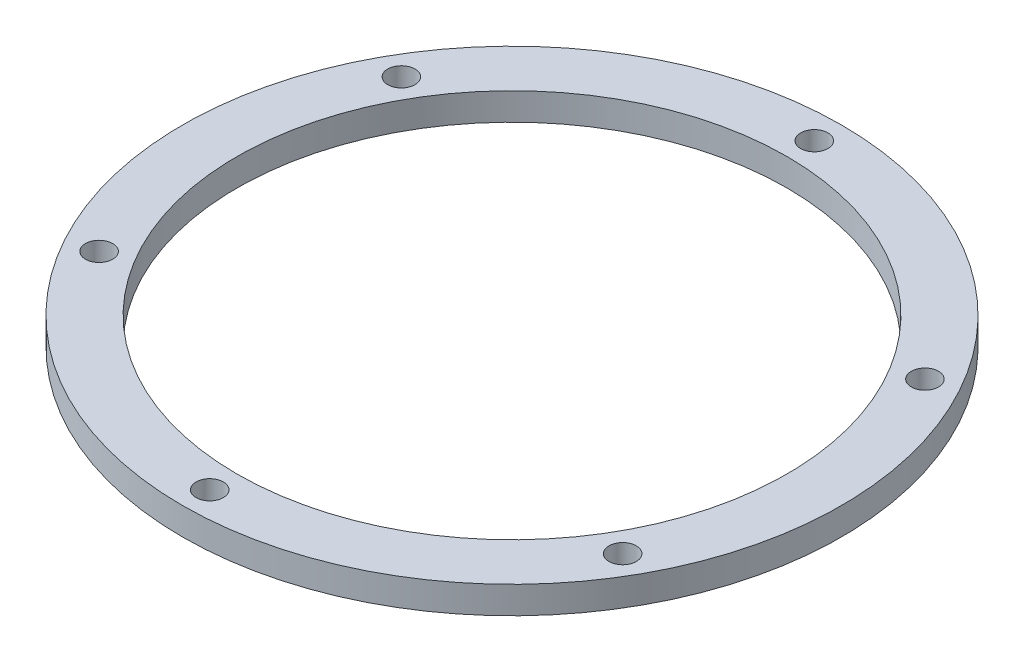
from build123d import *

# Parameters (mm, degrees)
SKETCH1_R           = 36.25
SKETCH1_R_2         = 30.25
BOSS_EXTRUDE1_DEPTH = 3
SKETCH2_R           = 1.5
CUT_EXTRUDE1_DEPTH  = 52.352945388
CIRPATTERN1_COUNT   = 6


with BuildPart() as part:
    # Sketch1 → Boss-Extrude1 (new body)
    with BuildSketch(Plane(origin=(0, 0, 0), x_dir=(1, 0, 0), z_dir=(0, 1, 0))):
        with Locations(Location((0, 0, 0), (0, 0, 270))):
            Circle(SKETCH1_R)
        with Locations(Location((0, 0, 0), (0, 0, 270))):
            Circle(SKETCH1_R_2, mode=Mode.SUBTRACT)
    extrude(amount=BOSS_EXTRUDE1_DEPTH)

    # Sketch2 → Cut-Extrude1 (cut, symmetric)
    with BuildSketch(Plane(origin=(0, 3, 0), x_dir=(1, 0, 0), z_dir=(0, 1, 0))):
        with Locations(Location((0, 33.25, 0), (0, 0, 270))):
            Circle(SKETCH2_R)
    cut_extrude1 = extrude(amount=CUT_EXTRUDE1_DEPTH, both=True, mode=Mode.SUBTRACT)

    # CirPattern1: Cut-Extrude1 ×6 about axis
    cirpattern1_axis = Axis((0, 0, 0), (0, 1, 0))
    for i in range(1, CIRPATTERN1_COUNT):
        add(cut_extrude1.rotate(cirpattern1_axis, i * 360 / CIRPATTERN1_COUNT), mode=Mode.SUBTRACT)


solid = part.part
